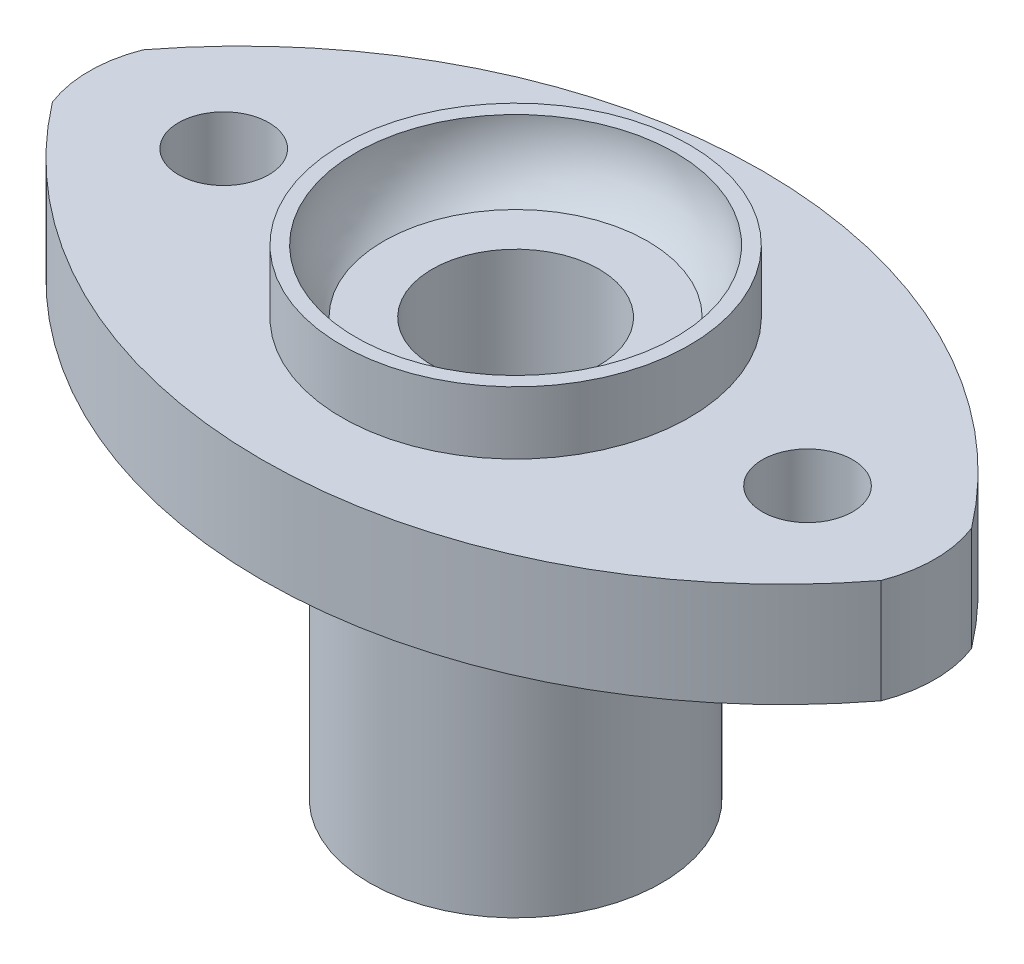
from build123d import *

# Parameters (mm, degrees)
BOSS_EXTRUDE3_START        = 15
SKETCH2_R                  = 12
BOSS_EXTRUDE3_DEPTH        = 15
F_13_0_13_DIAMETER_HOLE1_D = 13


with BuildPart() as part:
    # Sketch1 → Revolve1 (revolve)
    with BuildSketch(Plane.XY, mode=Mode.PRIVATE) as revolve1_sk:
        with BuildLine():
            Line((12, 0), (21, 0))
            Line((21, 0), (21, 60))
            Line((21, 60), (25, 60))
            Line((25, 60), (25, 69))
            Line((25, 69), (23, 69))
            ThreePointArc((23, 69), (19.845922252, 60.849571269), (12, 57))
            Line((12, 57), (12, 0))
        make_face()
    revolve(revolve1_sk.sketch.rotate(Axis((0, 0, 0), (0, 1, 0)), 90), axis=Axis((0, 0, 0), (0, 1, 0)))

    # Sketch2 → Boss-Extrude3 (add)
    with BuildSketch(Plane.XZ.offset(-60).offset(BOSS_EXTRUDE3_START)):
        with BuildLine():
            ThreePointArc((-60.125231169, 6.521519783), (-0.519935794, 36), (59.08535958, 6.521519783))
            ThreePointArc((59.08535958, 6.521519783), (60.308298463, 0), (59.08535958, -6.521519783))
            ThreePointArc((59.08535958, -6.521519783), (-0.519935794, -36), (-60.125231169, -6.521519783))
            ThreePointArc((-60.125231169, -6.521519783), (-61.348170052, 0), (-60.125231169, 6.521519783))
        make_face()
        with Locations(Location((0, 0, 0), (0, 0, 270))):
            Circle(SKETCH2_R, mode=Mode.SUBTRACT)
    extrude(amount=-BOSS_EXTRUDE3_DEPTH)

    # Ø13.0 (13) Diameter Hole1 (through all)
    with Locations(Plane(origin=(0, 60, 0), x_dir=(1, 0, 0), z_dir=(0, 1, 0))):
        with Locations((-42, 0), (42, 0)):
            Hole(F_13_0_13_DIAMETER_HOLE1_D / 2)

    # Sketch6 → Cut-Revolve5 (revolve, cut)
    with BuildSketch(Plane.XY, mode=Mode.PRIVATE) as cut_revolve5_sk:
        Polygon((21, 0), (12, 0), (12, 2.411542732), align=None)
    revolve(cut_revolve5_sk.sketch.rotate(Axis((0, 0, 0), (0, 1, 0)), 90), axis=Axis((0, 0, 0), (0, 1, 0)), mode=Mode.SUBTRACT)


solid = part.part
